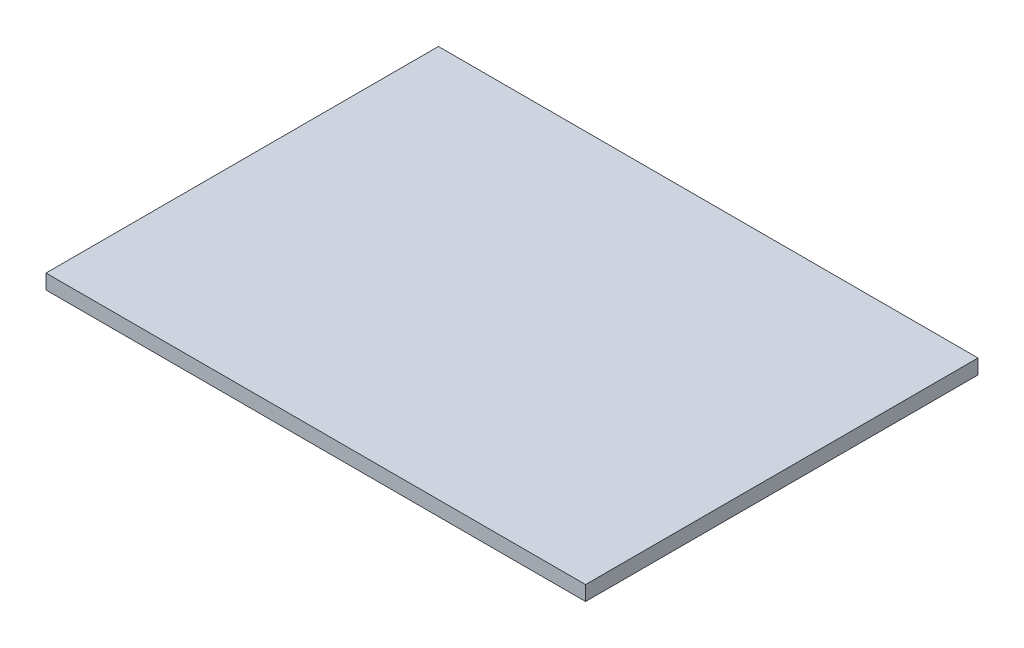
from build123d import *

# Parameters (mm, degrees)
BOSS_EXTRUDE1_DEPTH = 1.5


with BuildPart() as part:
    # Sketch1 → Boss-Extrude1 (new body)
    with BuildSketch(Plane(origin=(0, 0, 0), x_dir=(1, 0, 0), z_dir=(0, 1, 0))):
        Polygon((0, 40), (-3, 40), (-3, 0), (0, 0), (52, 0), (52, 40), align=None)
    extrude(amount=BOSS_EXTRUDE1_DEPTH)


solid = part.part
